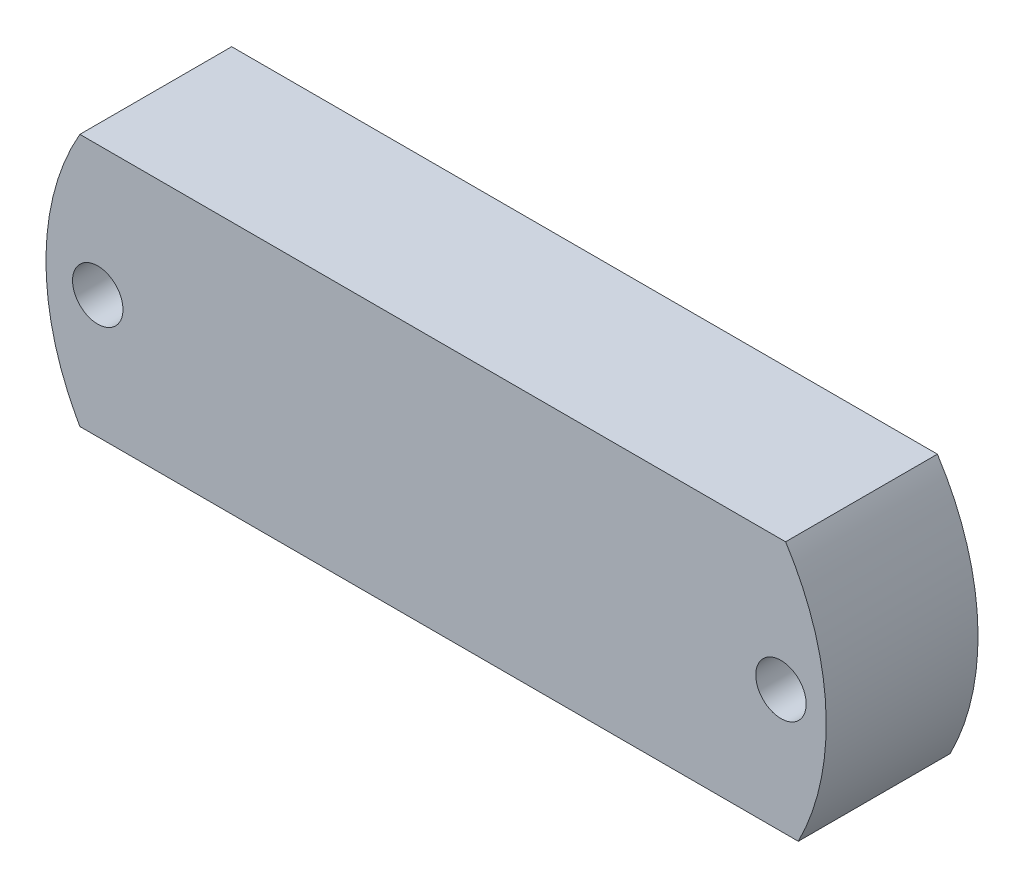
from build123d import *

# Parameters (mm, degrees)
SKETCH1_R             = 66.4845
BOSS_EXTRUDE1_DEPTH   = 11.43
CUT_EXTRUDE1_START    = -33.02
SKETCH3_W             = 41.275
SKETCH3_H             = 24.257
CUT_EXTRUDE1_DEPTH    = 46.278900076
SKETCH4_R             = 30.1625
CUT_EXTRUDE2_DEPTH    = 95.715481208
F_6_CLEARANCE_HOLE1_D = 3.7973
CIRPATTERN1_COUNT     = 5
CUT_EXTRUDE3_DEPTH    = 95.715481208
SKETCH9_W             = 90.169443187
SKETCH9_H             = 19.134747519
CUT_EXTRUDE4_DEPTH    = 82.281975988
CUT_EXTRUDE5_DEPTH    = 73.517528625


with BuildPart() as part:
    # Sketch1 → Boss-Extrude1 (new body)
    with BuildSketch(Plane.XY):
        Circle(SKETCH1_R)
    extrude(amount=BOSS_EXTRUDE1_DEPTH)

    # Sketch3 → Cut-Extrude1 (cut)
    with BuildSketch(Plane(origin=(0, 10.998843101, -24.703806075), x_dir=(1, 0, 0), z_dir=(0, -0.40673664307580104, 0.9135454576426005)).offset(CUT_EXTRUDE1_START)):
        with Locations((6.90118, 37.673412979)):
            Rectangle(SKETCH3_W, SKETCH3_H)
    cut_extrude1 = extrude(amount=CUT_EXTRUDE1_DEPTH, mode=Mode.SUBTRACT)

    # Sketch4 → Cut-Extrude2 (cut, through all)
    with BuildSketch(Plane(origin=(0, 0, 0), x_dir=(-1, 0, 0), z_dir=(0, 0, -1))):
        Circle(SKETCH4_R)
    extrude(amount=-CUT_EXTRUDE2_DEPTH, mode=Mode.SUBTRACT)

    # #6 Clearance Hole1 (through all)
    with Locations(Plane(origin=(0, 0, 0), x_dir=(-1, 0, 0), z_dir=(0, 0, -1))):
        with Locations((-32.61868, 45.624980685), (18.81632, 45.624980685)):
            f_6_clearance_hole1 = Hole(F_6_CLEARANCE_HOLE1_D / 2)

    # CirPattern1: Cut-Extrude1, #6 Clearance Hole1 ×5 about axis
    cirpattern1_axis = Axis((0, 0, 0), (0, 0, 1))
    add([cut_extrude1.rotate(cirpattern1_axis, i * 360 / CIRPATTERN1_COUNT) for i in range(1, CIRPATTERN1_COUNT)], mode=Mode.SUBTRACT)
    add([f_6_clearance_hole1.rotate(cirpattern1_axis, i * 360 / CIRPATTERN1_COUNT) for i in range(1, CIRPATTERN1_COUNT)], mode=Mode.SUBTRACT)

    # Sketch5 → Cut-Extrude3 (cut, through all)
    with BuildSketch(Plane(origin=(0, 0, 0), x_dir=(-1, 0, 0), z_dir=(0, 0, -1))):
        with BuildLine():
            Line((-45.34231997, 48.623685175), (0, 0))
            Line((0, 0), (32.232325197, 58.148653919))
            ThreePointArc((32.232325197, 58.148653919), (8.102422362, -65.988934619), (-45.34231997, 48.623685175))
        make_face()
    extrude(amount=-CUT_EXTRUDE3_DEPTH, mode=Mode.SUBTRACT)

    # Sketch9 → Cut-Extrude4 (cut, through all)
    with BuildSketch(Plane.XY.offset(11.43)):
        Polygon((-20.16444413, 36.377620169), (33.922679606, 36.377620169), (0, 0), align=None)
        with Locations((9.105457651, 64.994993929)):
            Rectangle(SKETCH9_W, SKETCH9_H)
    extrude(amount=-CUT_EXTRUDE4_DEPTH, mode=Mode.SUBTRACT)

    # Sketch10 → Cut-Extrude5 (cut, through all)
    with BuildSketch(Plane.XY.offset(11.43)):
        with BuildLine():
            Line((-20.16444413, 36.377620169), (-37.32827131, 36.377620169))
            Line((-37.32827131, 36.377620169), (-35.716510793, 61.307238028))
            Line((-35.716510793, 61.307238028), (-20.16444413, 55.427620169))
            ThreePointArc((-20.16444413, 55.427620169), (-22.716660188, 45.902620169), (-20.16444413, 36.377620169))
        make_face()
        with BuildLine():
            Line((33.922679606, 36.377620169), (47.375187835, 33.198791646))
            Line((47.375187835, 33.198791646), (54.157749271, 61.901964171))
            Line((54.157749271, 61.901964171), (32.96596662, 55.427620169))
            ThreePointArc((32.96596662, 55.427620169), (36.00025444, 46.03098199), (33.922679606, 36.377620169))
        make_face()
    extrude(amount=-CUT_EXTRUDE5_DEPTH, mode=Mode.SUBTRACT)


solid = part.part
